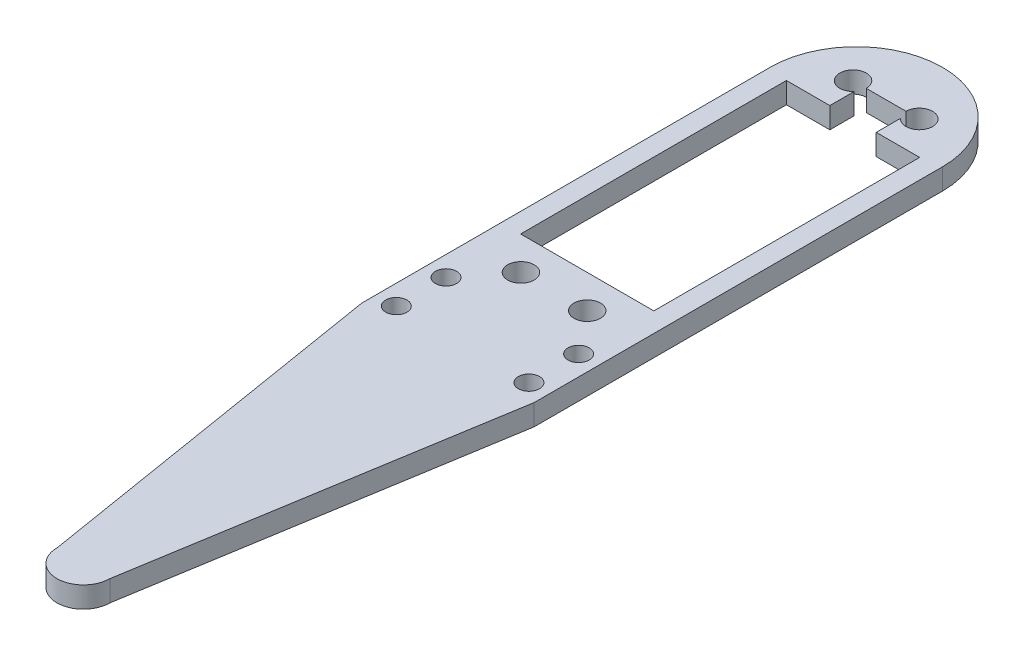
from build123d import *

# Parameters (mm, degrees)
SKETCH2_R               = 2
SKETCH2_W               = 20.1
SKETCH2_H               = 40.1
BOSS_EXTRUDE1_DEPTH     = 3.175
CUT_EXTRUDE1_DEPTH      = 122.340185532
CUT_EXTRUDE1_DEPTH_BACK = 122.340185532
SKETCH3_R               = 1.6
SKETCH4_W               = 7
SKETCH4_H               = 5
CUT_EXTRUDE2_DEPTH      = 3.175


with BuildPart() as part:
    # Sketch2 → Boss-Extrude1 (new body)
    with BuildSketch(Plane(origin=(0, 0, 0), x_dir=(1, 0, 0), z_dir=(0, 1, 0))):
        with BuildLine():
            Line((-13, 0), (-13, -61.6))
            Line((-13, -61.6), (-4, -116.6))
            ThreePointArc((-4, -116.6), (0, -120.6), (4, -116.6))
            Line((4, -116.6), (13, -61.6))
            Line((13, -61.6), (13, 0))
            ThreePointArc((13, 0), (0, 13), (-13, 0))
        make_face()
        with Locations(Location((-5, 4.5, 0), (0, 0, 270))):
            Circle(SKETCH2_R, mode=Mode.SUBTRACT)
        with Locations(Location((-5, -45.6, 0), (0, 0, 270))):
            Circle(SKETCH2_R, mode=Mode.SUBTRACT)
        with Locations(Location((5, -45.6, 0), (0, 0, 90))):
            Circle(SKETCH2_R, mode=Mode.SUBTRACT)
        with Locations(Location((5, 4.5, 0), (0, 0, 90))):
            Circle(SKETCH2_R, mode=Mode.SUBTRACT)
        with Locations((0, -20.55)):
            Rectangle(SKETCH2_W, SKETCH2_H, mode=Mode.SUBTRACT)
    extrude(amount=BOSS_EXTRUDE1_DEPTH)

    # Sketch3 → Cut-Extrude1 (cut, two sides: drawn at the far end of the back side and taken through both)
    with BuildSketch(Plane(origin=(0, 3.175, 0), x_dir=(1, 0, 0), z_dir=(0, 1, 0)).offset(-CUT_EXTRUDE1_DEPTH_BACK)):
        with Locations(Location((10, -59.4, 0), (0, 0, 270))):
            Circle(SKETCH3_R)
        with Locations(Location((10, -51.9, 0), (0, 0, 270))):
            Circle(SKETCH3_R)
        with Locations(Location((-10, -59.4, 0), (0, 0, 270))):
            Circle(SKETCH3_R)
        with Locations(Location((-10, -51.9, 0), (0, 0, 270))):
            Circle(SKETCH3_R)
    extrude(amount=CUT_EXTRUDE1_DEPTH + CUT_EXTRUDE1_DEPTH_BACK, mode=Mode.SUBTRACT)

    # Sketch4 → Cut-Extrude2 (cut)
    with BuildSketch(Plane(origin=(0, 3.175, 0), x_dir=(1, 0, 0), z_dir=(0, 1, 0))):
        with Locations((0, 2)):
            Rectangle(SKETCH4_W, SKETCH4_H)
    extrude(amount=-CUT_EXTRUDE2_DEPTH, mode=Mode.SUBTRACT)


solid = part.part
